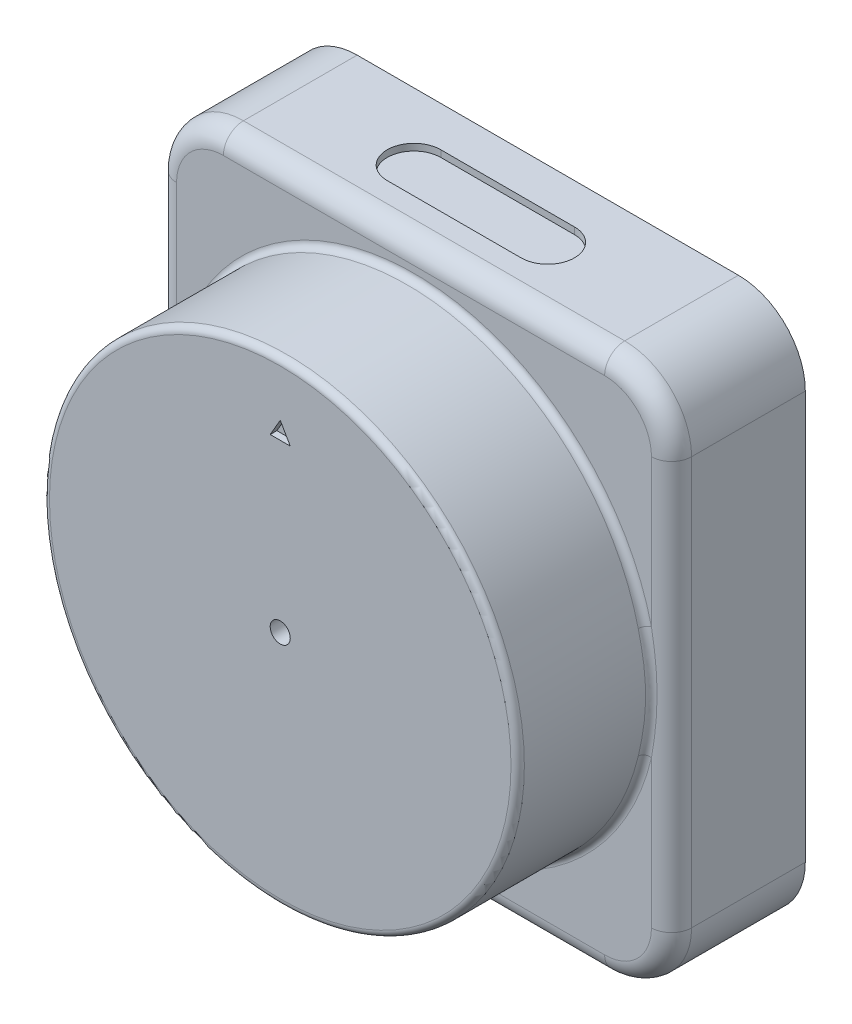
from build123d import *

# Parameters (mm, degrees)
SKETCH_1_W          = 77
SKETCH_1_H          = 81
EXTRUDE_1_DEPTH     = 20
FILLET_1_R          = 10
FILLET_2_R          = 3
SKETCH_3_R          = 35.5
EXTRUDE_2_DEPTH     = 20
FILLET_3_R          = 1
SKETCH_4_R          = 1.5
CUT_EXTRUDE_1_DEPTH = 10
CUT_EXTRUDE_2_DEPTH = 1
CUT_EXTRUDE_3_DEPTH = 1


with BuildPart() as part:
    # 草图1 → 凸台-拉伸1 (new body)
    with BuildSketch(Plane.XY):
        Rectangle(SKETCH_1_W, SKETCH_1_H)
    extrude(amount=EXTRUDE_1_DEPTH)

    # 圆角1
    fillet_1_edges = [part.edges().sort_by_distance(p)[0] for p in [
        (38.5, -40.5, 10),
        (-38.5, -40.5, 10),
        (-38.5, 40.5, 10),
        (38.5, 40.5, 10),
    ]]
    fillet(fillet_1_edges, radius=FILLET_1_R)

    # 圆角2
    fillet_2_edges = [part.edges().sort_by_distance(p)[0] for p in [
        (38.5, 0, 20),
        (0, -40.5, 20),
        (0, 40.5, 20),
        (-38.5, 0, 20),
        (-35.571067812, 37.571067812, 20),
        (-35.571067812, -37.571067812, 20),
        (35.571067812, 37.571067812, 20),
        (35.571067812, -37.571067812, 20),
    ]]
    fillet(fillet_2_edges, radius=FILLET_2_R)

    # 草图3 → 凸台-拉伸2 (add)
    with BuildSketch(Plane.XY.offset(20)):
        Circle(SKETCH_3_R)
    extrude(amount=EXTRUDE_2_DEPTH)

    # 圆角3
    fillet_3_edges = [part.edges().sort_by_distance(p)[0] for p in [
        (4e-08, 35.5, 20),
        (-4e-08, -35.5, 20),
        (-35.5, 0, 40),
    ]]
    fillet(fillet_3_edges, radius=FILLET_3_R)

    # 草图4 → 切除-拉伸1 (cut)
    with BuildSketch(Plane.XY.offset(40)):
        Circle(SKETCH_4_R)
    extrude(amount=-CUT_EXTRUDE_1_DEPTH, mode=Mode.SUBTRACT)

    # 草图5 → 切除-拉伸2 (cut)
    with BuildSketch(Plane(origin=(0, 40.5, 0), x_dir=(1, 0, 0), z_dir=(0, 1, 0))):
        with BuildLine():
            Line((-10, -6), (10, -6))
            ThreePointArc((10, -6), (14, -10), (10, -14))
            Line((10, -14), (-10, -14))
            ThreePointArc((-10, -14), (-14, -10), (-10, -6))
        make_face()
    extrude(amount=-CUT_EXTRUDE_2_DEPTH, mode=Mode.SUBTRACT)

    # 草图6 → 切除-拉伸3 (cut)
    with BuildSketch(Plane.XY.offset(40)):
        Polygon((0, 27.472496233), (-1.5, 24.874420022), (1.5, 24.874420022), align=None)
    extrude(amount=-CUT_EXTRUDE_3_DEPTH, mode=Mode.SUBTRACT)


solid = part.part
